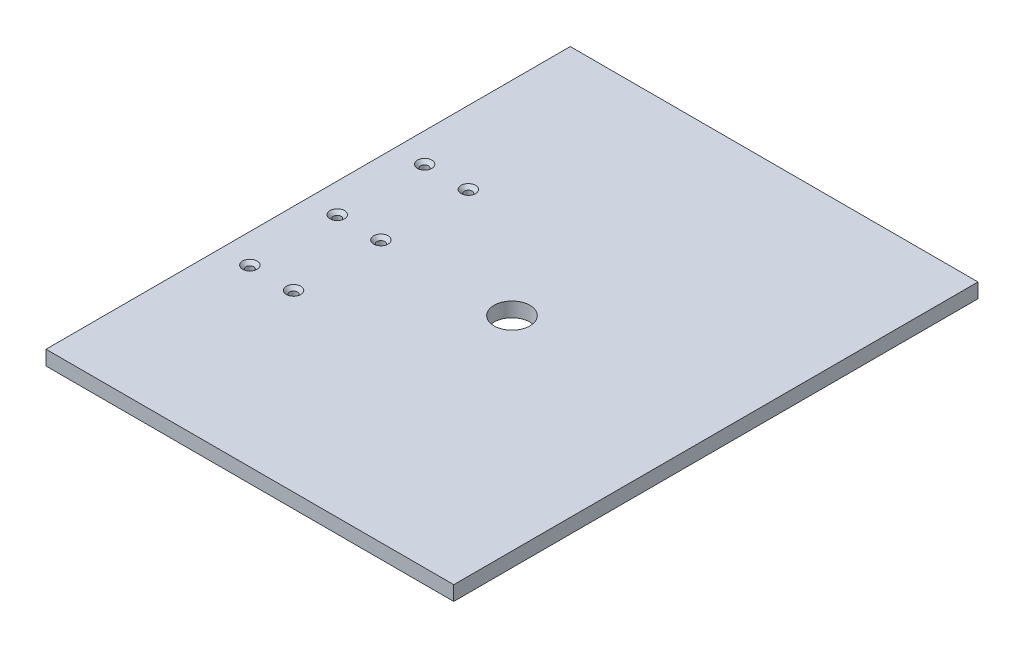
from build123d import *

# Parameters (mm, degrees)
SKETCH1_W                                            = 177.8
SKETCH1_H                                            = 228.6
BOSS_EXTRUDE1_DEPTH                                  = 6.35
CUT_EXTRUDE1_REACH                                   = 213.465
SKETCH6_R                                            = 7.810000001
THREADED_CSK_FOR_M3_10_FLAT_HEAD_MACHINE_D           = 3.4
THREADED_CSK_FOR_M3_10_FLAT_HEAD_MACHINE_CSINK_D     = 6.3
THREADED_CSK_FOR_M3_10_FLAT_HEAD_MACHINE_CSINK_ANGLE = 90


with BuildPart() as part:
    # Sketch1 → Boss-Extrude1 (new body)
    with BuildSketch(Plane(origin=(0, 0, 0), x_dir=(1, 0, 0), z_dir=(0, 1, 0))):
        with Locations((88.9, 0)):
            Rectangle(SKETCH1_W, SKETCH1_H)
    extrude(amount=BOSS_EXTRUDE1_DEPTH)

    # Sketch6 → Cut-Extrude1 (cut, up to next)
    with BuildSketch(Plane(origin=(0, 6.35, 0), x_dir=(1, 0, 0), z_dir=(0, 1, 0)), mode=Mode.PRIVATE) as cut_extrude1_sk1:
        with Locations(Location((88.9, 0, 0), (0, 0, 270))):
            Circle(SKETCH6_R)
    cut_extrude1_tool1 = extrude(cut_extrude1_sk1.sketch, amount=-CUT_EXTRUDE1_REACH, mode=Mode.PRIVATE) & part.part
    add(cut_extrude1_tool1.solids().sort_by_distance((88.9, 6.35, 0))[0], mode=Mode.SUBTRACT)

    # Threaded CSK for M3-10 Flat Head Machine Screw1 (through all)
    with Locations(Plane(origin=(0, 6.35, 0), x_dir=(-1, 0, 0), z_dir=(0, 1, 0))):
        with Locations((-12.7, 0), (-12.7, 38.1), (-31.75, 38.1), (-12.7, -38.1), (-31.75, -38.1), (-31.75, 0)):
            CounterSinkHole(THREADED_CSK_FOR_M3_10_FLAT_HEAD_MACHINE_D / 2, THREADED_CSK_FOR_M3_10_FLAT_HEAD_MACHINE_CSINK_D / 2, counter_sink_angle=THREADED_CSK_FOR_M3_10_FLAT_HEAD_MACHINE_CSINK_ANGLE)


solid = part.part
